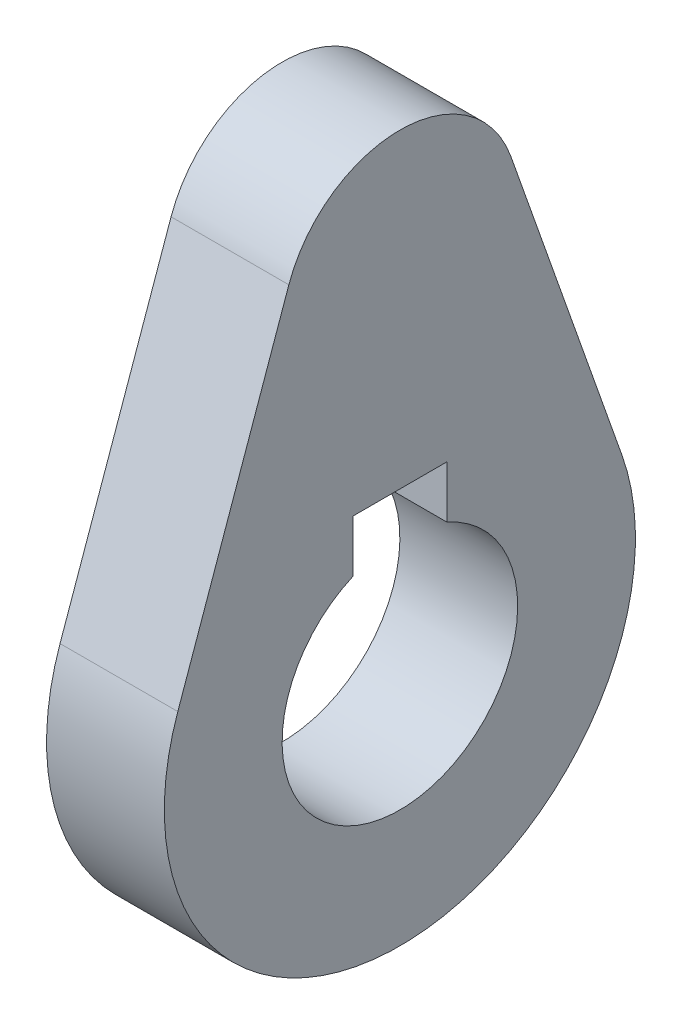
from build123d import *

# Parameters (mm, degrees)
BOSS_EXTRUDE1_DEPTH = 5


with BuildPart() as part:
    # Sketch1 → Boss-Extrude1 (new body)
    with BuildSketch(Plane(origin=(0, 0, 0), x_dir=(0, 0, -1), z_dir=(1, 0, 0))):
        with BuildLine():
            ThreePointArc((4.714045208, 16.666666667), (0, 20), (-4.714045208, 16.666666667))
            Line((-4.714045208, 16.666666667), (-9.428090416, 3.333333333))
            ThreePointArc((-9.428090416, 3.333333333), (0, -10), (9.428090416, 3.333333333))
            Line((9.428090416, 3.333333333), (4.714045208, 16.666666667))
        make_face()
        with BuildLine():
            ThreePointArc((2, 4.582575695), (0, -5), (-2, 4.582575695))
            Line((-2, 4.582575695), (-2, 6.802065863))
            Line((-2, 6.802065863), (2, 6.802065863))
            Line((2, 6.802065863), (2, 4.582575695))
        make_face(mode=Mode.SUBTRACT)
    extrude(amount=BOSS_EXTRUDE1_DEPTH)


solid = part.part
